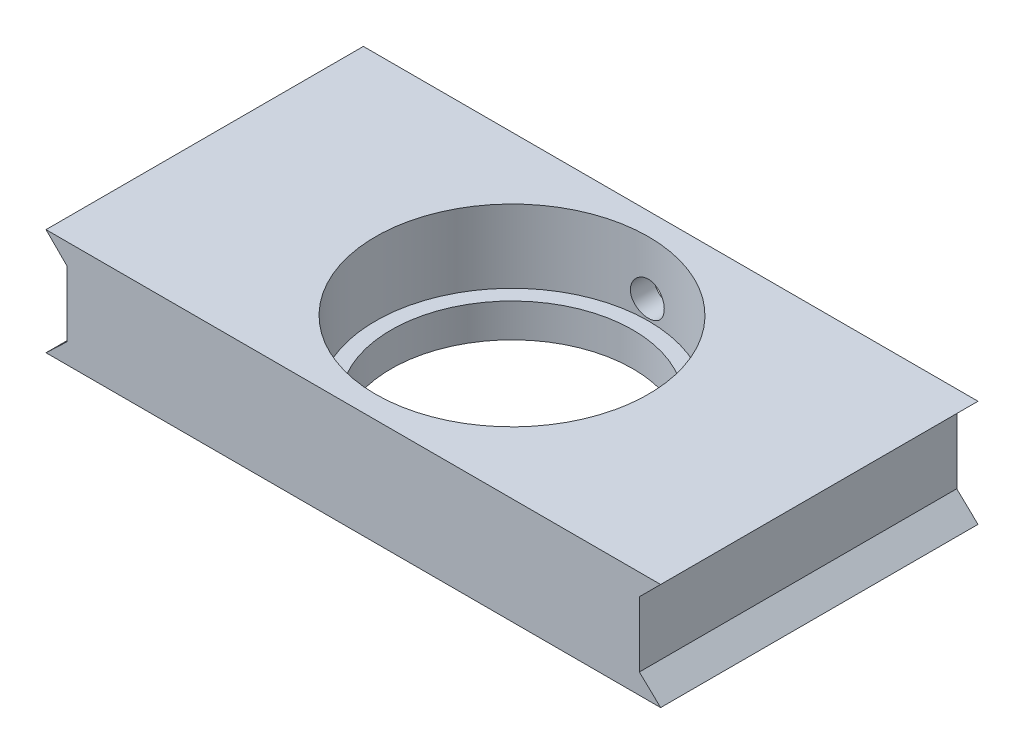
from build123d import *

# Parameters (mm, degrees)
EXTRUDE_1_DEPTH     = 30
SKETCH_2_R          = 11.43
CUT_EXTRUDE_1_DEPTH = 45.733812445
SKETCH_2_3_R        = 12.9
SKETCH_2_3_R_2      = 11.43
CUT_EXTRUDE_2_DEPTH = 6.9
SKETCH_3_R          = 1.6
CUT_EXTRUDE_3_DEPTH = 5


with BuildPart() as part:
    # 草图1 → 凸台-拉伸1 (new body)
    with BuildSketch(Plane.XY):
        Polygon((31.614989733, 7.516016427), (-26.485010267, 7.516016427), (-24.476827008, 5.507833169), (-24.476827008, -0.652166831), (-26.485010267, -2.563983573), (31.614989733, -2.563983573), (29.606806474, -0.652166831), (29.606806474, 5.507833169), align=None)
    extrude(amount=EXTRUDE_1_DEPTH)

    # 草图2 → 切除-拉伸1 (cut, through all)
    with BuildSketch(Plane(origin=(0, 7.516016427, 0), x_dir=(1, 0, 0), z_dir=(0, 1, 0))):
        with Locations((2.564989733, -15)):
            Circle(SKETCH_2_R)
    extrude(amount=-CUT_EXTRUDE_1_DEPTH, mode=Mode.SUBTRACT)

    # 草图2<3> → 切除-拉伸2 (cut)
    with BuildSketch(Plane(origin=(0, 7.516016427, 0), x_dir=(1, 0, 0), z_dir=(0, 1, 0))):
        with Locations((2.564989733, -15)):
            Circle(SKETCH_2_3_R)
        with Locations((2.564989733, -15)):
            Circle(SKETCH_2_3_R_2, mode=Mode.SUBTRACT)
    extrude(amount=-CUT_EXTRUDE_2_DEPTH, mode=Mode.SUBTRACT)

    # 草图3 → 切除-拉伸3 (cut)
    with BuildSketch(Plane(origin=(0, 0, 0), x_dir=(-1, 0, 0), z_dir=(0, 0, -1))):
        with Locations((-2.556806474, 2.427833169)):
            Circle(SKETCH_3_R)
    extrude(amount=-CUT_EXTRUDE_3_DEPTH, mode=Mode.SUBTRACT)


solid = part.part
